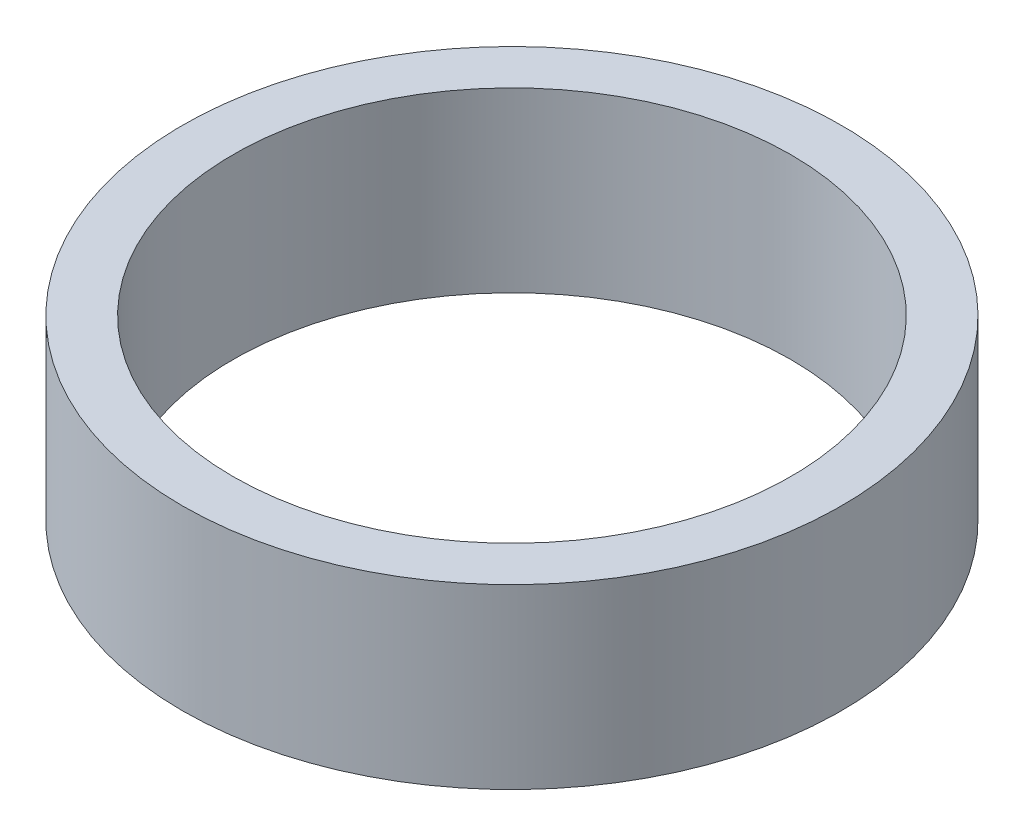
from build123d import *

# Parameters (mm, degrees)
SKETCH1_R           = 13
SKETCH1_R_2         = 11
BOSS_EXTRUDE1_DEPTH = 7


with BuildPart() as part:
    # Sketch1 → Boss-Extrude1 (new body)
    with BuildSketch(Plane(origin=(0, 0, 0), x_dir=(1, 0, 0), z_dir=(0, 1, 0))):
        with Locations(Location((0, 0, 0), (0, 0, 270))):
            Circle(SKETCH1_R)
        with Locations(Location((0, 0, 0), (0, 0, 270))):
            Circle(SKETCH1_R_2, mode=Mode.SUBTRACT)
    extrude(amount=BOSS_EXTRUDE1_DEPTH)


solid = part.part
